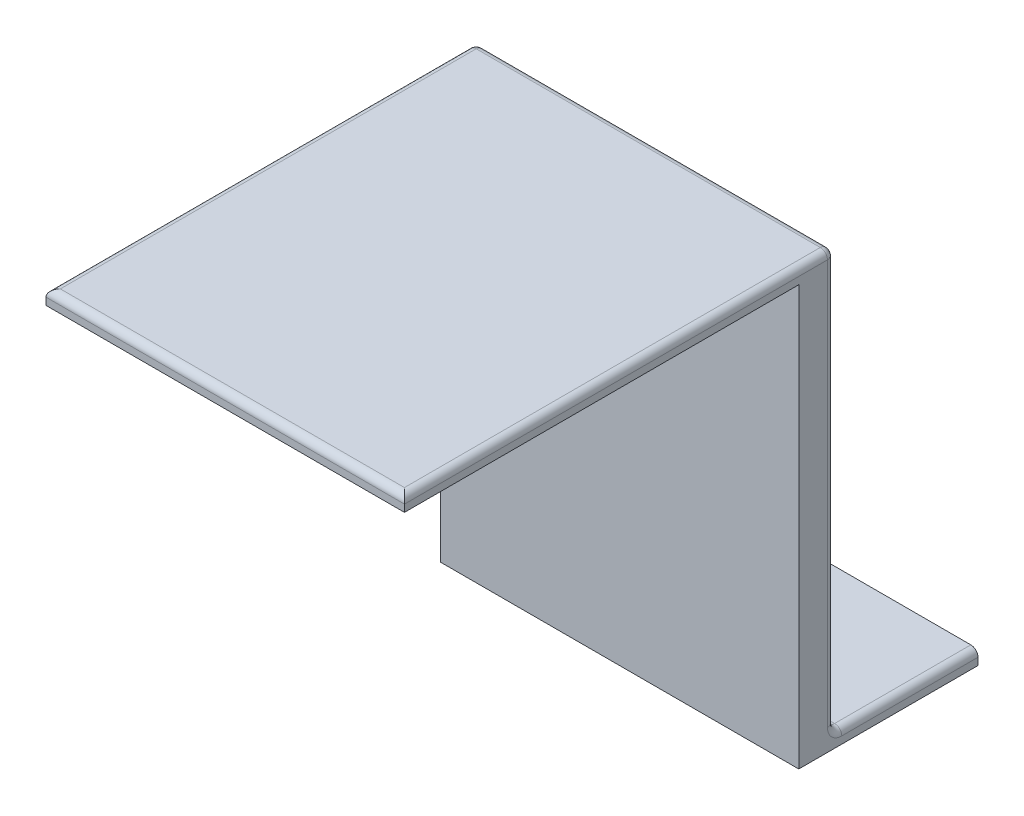
from build123d import *

# Parameters (mm, degrees)
SKETCH_1_W          = 50
SKETCH_1_H          = 60.5
EXTRUDE_1_DEPTH     = 60
SKETCH_3_W          = 50
SKETCH_3_H          = 58.5
CUT_EXTRUDE_1_DEPTH = 55
SKETCH_4_W          = 50
SKETCH_4_H          = 2
EXTRUDE_2_DEPTH     = 20
FILLET_5_R          = 1
SCALE_1_SCALE       = 1.7


with BuildPart() as part:
    # 草图1 → 凸台-拉伸1 (new body)
    with BuildSketch(Plane.XY):
        with Locations((6.818181818, -11.682037969)):
            Rectangle(SKETCH_1_W, SKETCH_1_H)
    extrude(amount=EXTRUDE_1_DEPTH)

    # 草图3 → 切除-拉伸1 (cut)
    with BuildSketch(Plane.XY.offset(60)):
        with Locations((6.818181818, -12.682037969)):
            Rectangle(SKETCH_3_W, SKETCH_3_H)
    extrude(amount=-CUT_EXTRUDE_1_DEPTH, mode=Mode.SUBTRACT)

    # 草图4 → 凸台-拉伸2 (add)
    with BuildSketch(Plane(origin=(0, 0, 0), x_dir=(-1, 0, 0), z_dir=(0, 0, -1))):
        with Locations((-6.818181818, -40.932037969)):
            Rectangle(SKETCH_4_W, SKETCH_4_H)
    extrude(amount=EXTRUDE_2_DEPTH)

    # 圆角5
    fillet_5_edges = [part.edges().sort_by_distance(p)[0] for p in [
        (6.818181818, 18.567962031, 60),
        (31.818181818, -10.682037969, 0),
        (6.818181818, -39.932037969, 0),
        (-18.181818182, -39.932037969, -10),
        (31.818181818, -39.932037969, -10),
        (6.818181818, 18.567962031, 0),
        (-18.181818182, -10.682037969, 0),
        (-18.181818182, 18.567962031, 30),
        (31.818181818, 18.567962031, 30),
    ]]
    fillet(fillet_5_edges, radius=FILLET_5_R)


with BuildPart() as part_1:
    # 缩放比例1: scaled about (0, 0, 0)
    add(part.part.scale(SCALE_1_SCALE))


solid = part_1.part
